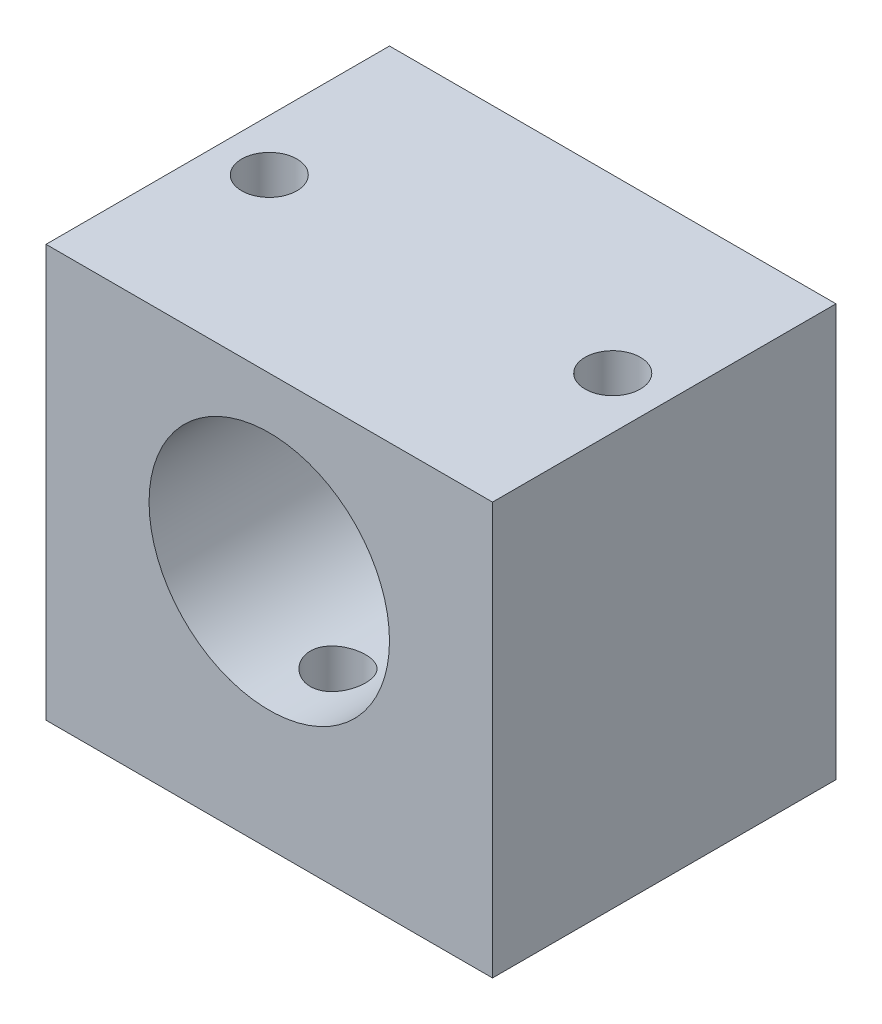
from build123d import *

# Parameters (mm, degrees)
SKETCH1_W                              = 31.75
SKETCH1_H                              = 38.1
BOSS_EXTRUDE1_DEPTH                    = 20.6375
HOLE1_D                                = 22.225
TAPPED_HOLE_FOR_10_32_HELICOIL1_D      = 5.1054
TAPPED_HOLE_FOR_10_32_HELICOIL2_REACH  = 48.147
TAPPED_HOLE_FOR_10_32_HELICOIL2_BORE_R = 2.5527


with BuildPart() as part:
    # Sketch1 → Boss-Extrude1 (new, symmetric)
    with BuildSketch(Plane(origin=(0, 0, 0), x_dir=(0, 0, -1), z_dir=(1, 0, 0))):
        Rectangle(SKETCH1_W, SKETCH1_H)
    extrude(amount=BOSS_EXTRUDE1_DEPTH, both=True)

    # Hole1 (through all)
    with Locations(Plane.XY.offset(15.875)):
        with Locations((0, 3.175)):
            Hole(HOLE1_D / 2)

    # Tapped Hole for #10-32 Helicoil1 (through all)
    with Locations(Plane(origin=(0, 19.05, 0), x_dir=(1, 0, 0), z_dir=(0, 1, 0))):
        with Locations((-15.875, 0), (15.875, 0)):
            Hole(TAPPED_HOLE_FOR_10_32_HELICOIL1_D / 2)

    # Tapped Hole for #10-32 Helicoil2 bore → Tapped Hole for #10-32 Helicoil2 (cut, up to next)
    with BuildSketch(Plane(origin=(0, -19.05, 0), x_dir=(-1, 0, 0), z_dir=(0, -1, 0)), mode=Mode.PRIVATE) as tapped_hole_for_10_32_helicoil2_sk1:
        with Locations((0, 9.525)):
            Circle(TAPPED_HOLE_FOR_10_32_HELICOIL2_BORE_R)
    tapped_hole_for_10_32_helicoil2_tool1 = extrude(tapped_hole_for_10_32_helicoil2_sk1.sketch, amount=-TAPPED_HOLE_FOR_10_32_HELICOIL2_REACH, mode=Mode.PRIVATE) & part.part
    # Tapped Hole for #10-32 Helicoil2 bore → Tapped Hole for #10-32 Helicoil2 (cut, up to next)
    with BuildSketch(Plane(origin=(0, -19.05, 0), x_dir=(-1, 0, 0), z_dir=(0, -1, 0)), mode=Mode.PRIVATE) as tapped_hole_for_10_32_helicoil2_sk2:
        with Locations((0, -9.525)):
            Circle(TAPPED_HOLE_FOR_10_32_HELICOIL2_BORE_R)
    tapped_hole_for_10_32_helicoil2_tool2 = extrude(tapped_hole_for_10_32_helicoil2_sk2.sketch, amount=-TAPPED_HOLE_FOR_10_32_HELICOIL2_REACH, mode=Mode.PRIVATE) & part.part
    add(tapped_hole_for_10_32_helicoil2_tool1.solids().sort_by_distance((0, -19.05, -9.525))[0], mode=Mode.SUBTRACT)
    add(tapped_hole_for_10_32_helicoil2_tool2.solids().sort_by_distance((0, -19.05, 9.525))[0], mode=Mode.SUBTRACT)


solid = part.part
